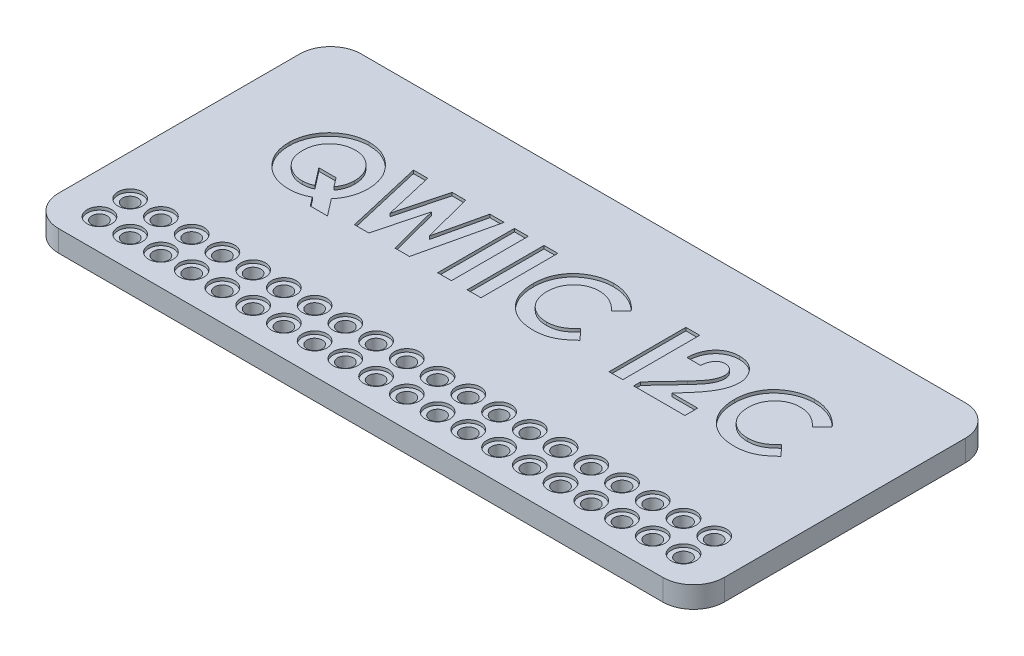
from build123d import *

# Parameters (mm, degrees)
SKETCH1_W           = 55
SKETCH1_H           = 25
BOSS_EXTRUDE1_DEPTH = 1.764763264
SKETCH2_W           = 1.13974359
SKETCH2_H           = 6.35
CUT_EXTRUDE1_DEPTH  = 0.254
SKETCH3_R           = 0.635
CUT_EXTRUDE2_DEPTH  = 31.259120896
SKETCH4_R           = 1.016
CUT_EXTRUDE3_DEPTH  = 0.254
SKETCH5_W           = 6.096
SKETCH5_H           = 4.318
BOSS_EXTRUDE2_DEPTH = 4.318
FILLET1_R           = 2.54


with BuildPart() as part:
    # Sketch1 → Boss-Extrude1 (new body)
    with BuildSketch(Plane(origin=(0, 0, 0), x_dir=(1, 0, 0), z_dir=(0, 1, 0))):
        Rectangle(SKETCH1_W, SKETCH1_H)
    extrude(amount=BOSS_EXTRUDE1_DEPTH)

    # Sketch2 → Cut-Extrude1 (cut)
    # profile 1 of 8: a face of its own
    with BuildSketch(Plane(origin=(0, 1.764763264, 0), x_dir=(1, 0, 0), z_dir=(0, 1, 0))):
        with BuildLine():
            Line((-15.834294872, 0.904417067), (-14.75688101, -0.488461538))
            Line((-14.75688101, -0.488461538), (-16.175200321, -0.488461538))
            Line((-16.175200321, -0.488461538), (-16.733623798, 0.232782452))
            add(Edge.make_bspline(
                [(-16.733623798, 0.232782452), (-16.792116964, 0.200932374), (-16.908827383, 0.137382456), (-17.091844715, 0.058136216), (-17.278250026, -0.011384371), (-17.470744385, -0.065860672), (-17.667479678, -0.108740135), (-17.869475274, -0.141479308), (-18.076586637, -0.158741946), (-18.216364964, -0.161454203), (-18.286778846, -0.162820513)],
                knots=[0, 0, 0, 0, 0.985706899, 1.966764212, 2.949968678, 3.929638882, 4.925906056, 5.930211904, 6.957336097, 8, 8, 8, 8], degree=3))
            add(Edge.make_bspline(
                [(-18.286778846, -0.162820513), (-18.40398866, -0.160189738), (-18.633880946, -0.155029804), (-18.970564269, -0.105484327), (-19.292870578, -0.03068412), (-19.599603494, 0.078602809), (-19.891796355, 0.21748214), (-20.167113329, 0.389589865), (-20.428756821, 0.590154232), (-20.67032541, 0.821143618), (-20.891356901, 1.071463593), (-21.084485579, 1.33740966), (-21.248657638, 1.614832494), (-21.382544595, 1.904167279), (-21.486655312, 2.205912823), (-21.559563224, 2.519244963), (-21.605785673, 2.844596723), (-21.611515066, 3.065448537), (-21.614423077, 3.177544071)],
                knots=[0, 0, 0, 0, 1.070144486, 2.098953612, 3.10240755, 4.088674545, 5.067611437, 6.052256776, 7.0494179, 8.074208254, 9.100739571, 10.09639475, 11.072322686, 12.041159829, 13.004031207, 13.983083054, 14.976293755, 16, 16, 16, 16], degree=3))
            add(Edge.make_bspline(
                [(-21.614423077, 3.177544071), (-21.613453659, 3.252654762), (-21.611527097, 3.401925072), (-21.588356007, 3.623141223), (-21.554924945, 3.84001928), (-21.505839646, 4.05139349), (-21.445314105, 4.258814579), (-21.368303654, 4.460633347), (-21.279055747, 4.65876622), (-21.176668642, 4.851567196), (-21.060370692, 5.03618561), (-20.936786419, 5.214088417), (-20.79931849, 5.379563519), (-20.652832499, 5.53633747), (-20.496847292, 5.684307583), (-20.328906335, 5.820423875), (-20.152200973, 5.948064266), (-19.965458009, 6.064552806), (-19.771919359, 6.169847138), (-19.573366317, 6.261355055), (-19.371310124, 6.339639166), (-19.165675395, 6.403410708), (-18.95583663, 6.451201049), (-18.743640244, 6.487588199), (-18.527162103, 6.507828957), (-18.381796204, 6.511145864), (-18.308403446, 6.512820513)],
                knots=[0, 0, 0, 0, 1.035855852, 2.058595393, 3.065553363, 4.06176554, 5.050183643, 6.044349766, 7.039272903, 8.046842428, 9.053256483, 10.04817962, 11.033146707, 12.018200652, 13.007259073, 13.996749908, 14.99846043, 16.012935138, 17.03119782, 18.036301871, 19.027088812, 20.018894167, 21.003704893, 21.994284571, 22.987348552, 24, 24, 24, 24], degree=3))
            add(Edge.make_bspline(
                [(-18.308403446, 6.512820513), (-18.197568588, 6.510002186), (-17.97916831, 6.504448668), (-17.65790292, 6.456961095), (-17.348093046, 6.381314534), (-17.051016184, 6.272020074), (-16.764856598, 6.134214357), (-16.492466249, 5.963701782), (-16.230962742, 5.763998575), (-15.985995465, 5.535008837), (-15.759609641, 5.286499829), (-15.562254621, 5.019877359), (-15.395181722, 4.740232121), (-15.25585029, 4.447452627), (-15.150879438, 4.139827796), (-15.075942845, 3.819400064), (-15.028510164, 3.485943998), (-15.022995101, 3.258690783), (-15.020192308, 3.143199119)],
                knots=[0, 0, 0, 0, 1.015551519, 2.00114601, 2.970254478, 3.93428303, 4.897362978, 5.876714212, 6.874912676, 7.909046156, 8.946527051, 9.952474942, 10.9443724, 11.928494229, 12.919233427, 13.917651329, 14.941735923, 16, 16, 16, 16], degree=3))
            add(Edge.make_bspline(
                [(-15.020192308, 3.143199119), (-15.022522433, 3.036649152), (-15.027105331, 2.82708637), (-15.066808256, 2.518147352), (-15.129476341, 2.22037152), (-15.219482998, 1.933547254), (-15.333546142, 1.657987186), (-15.475669162, 1.394511671), (-15.639554937, 1.139992719), (-15.769057941, 0.983333765), (-15.834294872, 0.904417067)],
                knots=[0, 0, 0, 0, 1.049646143, 2.064447078, 3.064298101, 4.044929938, 5.022708814, 5.998521441, 6.991758374, 8, 8, 8, 8], degree=3))
        make_face()
        with BuildLine():
            add(Edge.make_bspline(
                [(-16.582251603, 1.873707933), (-16.548325017, 1.922348156), (-16.481253486, 2.018507971), (-16.396386347, 2.171030514), (-16.323484515, 2.326524897), (-16.263197554, 2.485807056), (-16.217337332, 2.649789814), (-16.184740921, 2.817402638), (-16.163154991, 2.988722288), (-16.16101454, 3.104124683), (-16.159935897, 3.162279647)],
                knots=[0, 0, 0, 0, 1.031533623, 2.039301536, 3.033003023, 4.018477747, 4.999688364, 5.992485227, 6.988348989, 8, 8, 8, 8], degree=3))
            add(Edge.make_bspline(
                [(-16.159935897, 3.162279647), (-16.161943424, 3.237845659), (-16.165894935, 3.386585829), (-16.195573941, 3.605236068), (-16.24529398, 3.814781972), (-16.314621115, 4.015736428), (-16.401927664, 4.208615283), (-16.511603135, 4.391812485), (-16.640457409, 4.566279532), (-16.787246621, 4.730336235), (-16.947061538, 4.880484434), (-17.117028584, 5.012720876), (-17.295981844, 5.124280889), (-17.484026003, 5.214358315), (-17.679121234, 5.286909289), (-17.883361204, 5.335605876), (-18.094965737, 5.367534661), (-18.239170909, 5.371213413), (-18.312219551, 5.373076923)],
                knots=[0, 0, 0, 0, 1.056263418, 2.079093448, 3.078410197, 4.062632158, 5.04680056, 6.032966551, 7.041959893, 8.074807684, 9.106532056, 10.103754224, 11.080880922, 12.048629763, 13.014470275, 13.984975, 14.979267944, 16, 16, 16, 16], degree=3))
            add(Edge.make_bspline(
                [(-18.312219551, 5.373076923), (-18.387371614, 5.371110704), (-18.535286953, 5.367240764), (-18.75243943, 5.336989388), (-18.96073452, 5.289538978), (-19.159077336, 5.219869765), (-19.348068424, 5.132085037), (-19.527699114, 5.024371468), (-19.697069167, 4.896125921), (-19.856581268, 4.751104817), (-20.00070603, 4.590183753), (-20.127976716, 4.417622418), (-20.234498979, 4.233836915), (-20.323707473, 4.040500879), (-20.390862832, 3.835449288), (-20.438695281, 3.620285919), (-20.46892368, 3.394640698), (-20.472734001, 3.240818619), (-20.474679487, 3.162279647)],
                knots=[0, 0, 0, 0, 1.042613217, 2.052085894, 3.036973397, 4.002832266, 4.963730975, 5.924467509, 6.903642813, 7.907474205, 8.911719447, 9.896835452, 10.877830278, 11.85475743, 12.846581833, 13.865885605, 14.910357018, 16, 16, 16, 16], degree=3))
            add(Edge.make_bspline(
                [(-20.474679487, 3.162279647), (-20.472100636, 3.075240402), (-20.467046516, 2.904657902), (-20.431469273, 2.65582353), (-20.370642583, 2.420798568), (-20.282664541, 2.200851867), (-20.173947341, 1.992886648), (-20.036982251, 1.801332194), (-19.877717026, 1.622401032), (-19.754775809, 1.518247205), (-19.692377804, 1.465384615)],
                knots=[0, 0, 0, 0, 1.078047314, 2.112794111, 3.106520711, 4.077995885, 5.041371964, 6.006121678, 6.988020189, 8, 8, 8, 8], degree=3))
            add(Edge.make_bspline(
                [(-19.692377804, 1.465384615), (-19.641324362, 1.426252868), (-19.540081078, 1.34865131), (-19.37789824, 1.250423386), (-19.211670368, 1.165092352), (-19.039825689, 1.096871117), (-18.862957847, 1.042615035), (-18.681104452, 1.005031636), (-18.493910282, 0.981108193), (-18.367414459, 0.978330577), (-18.303315304, 0.976923077)],
                knots=[0, 0, 0, 0, 1.027457745, 2.037535419, 3.025615023, 4.011018129, 4.9886297, 5.978868484, 6.975833209, 8, 8, 8, 8], degree=3))
            add(Edge.make_bspline(
                [(-18.303315304, 0.976923077), (-18.229771649, 0.979264788), (-18.083801028, 0.983912654), (-17.86894524, 1.024399703), (-17.659605991, 1.084949011), (-17.528366854, 1.146841689), (-17.4625, 1.177904647)],
                knots=[0, 0, 0, 0, 1.010952568, 2.006554787, 2.999521277, 4, 4, 4, 4], degree=3))
            Line((-17.4625, 1.177904647), (-18.565354567, 2.605128205))
            Line((-18.565354567, 2.605128205), (-17.147035256, 2.605128205))
            Line((-17.147035256, 2.605128205), (-16.582251603, 1.873707933))
        make_face(mode=Mode.SUBTRACT)
    # profile 2 of 8: a face of its own
    with BuildSketch(Plane(origin=(0, 1.764763264, 0), x_dir=(1, 0, 0), z_dir=(0, 1, 0))):
        Polygon((-14.491025641, 6.35), (-13.314393029, 6.35), (-12.374358974, 2.296023638), (-11.296945112, 6.35), (-10.189002404, 6.35), (-9.117948718, 2.296023638), (-8.180458734, 6.35), (-7.001282051, 6.35), (-8.470482772, 0), (-9.661107772, 0), (-10.746153846, 4.104857772), (-11.837560096, 0), (-13.019280849, 0), align=None)
    # profile 3 of 8: a face of its own
    with BuildSketch(Plane(origin=(0, 1.764763264, 0), x_dir=(1, 0, 0), z_dir=(0, 1, 0))):
        with Locations((-5.576602564, 3.175)):
            Rectangle(SKETCH2_W, SKETCH2_H)
    # profile 4 of 8: a face of its own
    with BuildSketch(Plane(origin=(0, 1.764763264, 0), x_dir=(1, 0, 0), z_dir=(0, 1, 0))):
        with Locations((-3.134294872, 3.175)):
            Rectangle(SKETCH2_W, SKETCH2_H)
    # profile 5 of 8: a face of its own
    with BuildSketch(Plane(origin=(0, 1.764763264, 0), x_dir=(1, 0, 0), z_dir=(0, 1, 0))):
        with BuildLine():
            Line((4.599679487, 5.248417468), (3.763952324, 4.449579327))
            add(Edge.make_bspline(
                [(3.763952324, 4.449579327), (3.693059137, 4.522883001), (3.554582534, 4.666068041), (3.331444613, 4.855632415), (3.099389301, 5.013608672), (2.862930769, 5.14665527), (2.617815814, 5.247314504), (2.366878632, 5.320666583), (2.108516916, 5.365386573), (1.933667645, 5.370503331), (1.845723157, 5.373076923)],
                knots=[0, 0, 0, 0, 1.115251505, 2.178435587, 3.19620269, 4.182487026, 5.141301733, 6.088180966, 7.038406374, 8, 8, 8, 8], degree=3))
            add(Edge.make_bspline(
                [(1.845723157, 5.373076923), (1.772278823, 5.371043695), (1.62734452, 5.367031345), (1.414542985, 5.337616856), (1.210987318, 5.287596239), (1.015980717, 5.218658562), (0.830096998, 5.129456867), (0.65294643, 5.020060193), (0.484965773, 4.891456549), (0.328373953, 4.744311336), (0.18512926, 4.583544132), (0.058563452, 4.41200591), (-0.047455715, 4.230089652), (-0.13446392, 4.039637675), (-0.202239948, 3.83976847), (-0.250640548, 3.630616599), (-0.278634161, 3.411932978), (-0.282812396, 3.263273482), (-0.284935897, 3.187720353)],
                knots=[0, 0, 0, 0, 1.035432265, 2.043311493, 3.022114605, 3.98653278, 4.95457646, 5.923598177, 6.917315552, 7.932509744, 8.948865224, 9.949768934, 10.933144597, 11.912367597, 12.897413939, 13.903909035, 14.934704909, 16, 16, 16, 16], degree=3))
            add(Edge.make_bspline(
                [(-0.284935897, 3.187720353), (-0.284323928, 3.13469188), (-0.283117725, 3.030171672), (-0.269913696, 2.875557275), (-0.248652096, 2.725544757), (-0.217881292, 2.580361347), (-0.1794021, 2.439881229), (-0.134257246, 2.302892487), (-0.077623691, 2.171287997), (-0.01475959, 2.043539259), (0.058350635, 1.923132056), (0.137176945, 1.808313796), (0.222651208, 1.699647305), (0.315327046, 1.597576816), (0.416508757, 1.503697461), (0.523581167, 1.415186177), (0.63835044, 1.334258702), (0.758432527, 1.25888407), (0.884864786, 1.193405487), (1.014216817, 1.13409454), (1.148449857, 1.085925233), (1.285929537, 1.047096377), (1.426164555, 1.014078234), (1.570526538, 0.993747949), (1.71776405, 0.978352061), (1.817271894, 0.977401455), (1.867347756, 0.976923077)],
                knots=[0, 0, 0, 0, 1.103660481, 2.175337485, 3.227646561, 4.255952547, 5.262355991, 6.258840057, 7.255597736, 8.242457506, 9.22035537, 10.185017736, 11.140346927, 12.096287581, 13.051739095, 14.01125915, 14.986044842, 15.97314143, 16.960198552, 17.947847494, 18.933482797, 19.925264591, 20.920966487, 21.929612487, 22.958107872, 24, 24, 24, 24], degree=3))
            add(Edge.make_bspline(
                [(1.867347756, 0.976923077), (1.952285024, 0.979379913), (2.119164669, 0.984206958), (2.364084542, 1.021953766), (2.597468781, 1.084045128), (2.783941671, 1.157371419), (2.930038255, 1.229782084), (3.041259425, 1.296758383), (3.156270783, 1.371678726), (3.273162089, 1.45737069), (3.393248139, 1.552805936), (3.514409136, 1.660074673), (3.639746823, 1.775644697), (3.7218543, 1.858129293), (3.763952324, 1.900420673)],
                knots=[0, 0, 0, 0, 1.404581149, 2.759636711, 4.088442092, 5.392261763, 6.066678138, 6.783632037, 7.538459478, 8.336747902, 9.180226004, 10.074962426, 11.012997595, 12, 12, 12, 12], degree=3))
            Line((3.763952324, 1.900420673), (4.574238782, 1.049429087))
            add(Edge.make_bspline(
                [(4.574238782, 1.049429087), (4.517280005, 0.994437176), (4.406108655, 0.887104727), (4.238409758, 0.734702665), (4.070921917, 0.59775247), (3.907691289, 0.471283451), (3.746043986, 0.358979957), (3.585997151, 0.26072983), (3.429362584, 0.174048181), (3.272887717, 0.100396854), (3.115598883, 0.037859228), (2.953767157, -0.015981563), (2.786897804, -0.061528935), (2.613971662, -0.098279682), (2.436601681, -0.127748821), (2.253127914, -0.147640319), (2.064713674, -0.161012711), (1.936909376, -0.162214331), (1.872435897, -0.162820513)],
                knots=[0, 0, 0, 0, 1.244526981, 2.429050516, 3.560637417, 4.644440555, 5.67424972, 6.652764056, 7.595344123, 8.486817594, 9.369275933, 10.254498637, 11.166417451, 12.086725134, 13.032340136, 13.991389299, 14.986715468, 16, 16, 16, 16], degree=3))
            add(Edge.make_bspline(
                [(1.872435897, -0.162820513), (1.754006104, -0.159801501), (1.522271919, -0.153894135), (1.182671512, -0.110124548), (0.860060241, -0.036745608), (0.553653254, 0.067032454), (0.263547981, 0.199604063), (-0.010181361, 0.362130632), (-0.26709358, 0.554180352), (-0.505113331, 0.773502214), (-0.720413525, 1.015724798), (-0.910713962, 1.275805403), (-1.068130492, 1.555022228), (-1.198836828, 1.84925035), (-1.301047464, 2.159832444), (-1.372986424, 2.487104468), (-1.417350656, 2.830750419), (-1.422204166, 3.065468525), (-1.424679487, 3.185176282)],
                knots=[0, 0, 0, 0, 1.078019885, 2.10938526, 3.111377082, 4.085535484, 5.04941344, 6.010039228, 6.978205633, 7.964457913, 8.951525778, 9.924444315, 10.892603023, 11.863865945, 12.85144698, 13.863884204, 14.910567087, 16, 16, 16, 16], degree=3))
            add(Edge.make_bspline(
                [(-1.424679487, 3.185176282), (-1.423633536, 3.26324866), (-1.421560717, 3.417969031), (-1.399775196, 3.645884672), (-1.369404914, 3.868061655), (-1.321225222, 4.082193045), (-1.263149355, 4.291163588), (-1.190924384, 4.492702018), (-1.104665663, 4.687387576), (-1.007153513, 4.875546178), (-0.896838993, 5.055945184), (-0.773605564, 5.227034681), (-0.640625734, 5.390135449), (-0.494704216, 5.543083654), (-0.337961441, 5.68722221), (-0.169689731, 5.821770003), (0.009098841, 5.948656601), (0.198888192, 6.064609906), (0.395991218, 6.169495833), (0.597921932, 6.2620097), (0.804184215, 6.339329989), (1.01390597, 6.403464316), (1.227973268, 6.451336056), (1.444858153, 6.48757342), (1.666406054, 6.507830337), (1.815156277, 6.511146524), (1.890244391, 6.512820513)],
                knots=[0, 0, 0, 0, 1.071919942, 2.124283339, 3.142214191, 4.149696895, 5.136002878, 6.119640489, 7.086990633, 8.058538607, 9.028339693, 9.988281803, 10.952401235, 11.916291999, 12.888973767, 13.874849856, 14.873389453, 15.898127285, 16.927174885, 17.938320013, 18.946391617, 19.950418109, 20.947802303, 21.956882652, 22.968648068, 24, 24, 24, 24], degree=3))
            add(Edge.make_bspline(
                [(1.890244391, 6.512820513), (1.954302252, 6.511860941), (2.081751949, 6.509951773), (2.271545936, 6.494036786), (2.45982204, 6.469042458), (2.645906174, 6.431331341), (2.831129402, 6.38656348), (3.013057684, 6.32794614), (3.194561036, 6.262606069), (3.372792848, 6.184505355), (3.548001906, 6.099251372), (3.716083661, 6.002527631), (3.87986019, 5.900286405), (4.035702304, 5.786476609), (4.186529262, 5.665226336), (4.331552376, 5.535969886), (4.469498982, 5.396552174), (4.556066613, 5.298045331), (4.599679487, 5.248417468)],
                knots=[0, 0, 0, 0, 0.996412454, 1.982464992, 2.961075852, 3.949442424, 4.934965278, 5.923860011, 6.921385422, 7.934793307, 8.949617135, 9.951082467, 10.950285876, 11.951772932, 12.951063433, 13.960125323, 14.972308753, 16, 16, 16, 16], degree=3))
        make_face()
    # profile 6 of 8: a face of its own
    with BuildSketch(Plane(origin=(0, 1.764763264, 0), x_dir=(1, 0, 0), z_dir=(0, 1, 0))):
        with Locations((8.588782051, 3.175)):
            Rectangle(SKETCH2_W, SKETCH2_H)
    # profile 7 of 8: a face of its own
    with BuildSketch(Plane(origin=(0, 1.764763264, 0), x_dir=(1, 0, 0), z_dir=(0, 1, 0))):
        with BuildLine():
            Line((11.356730769, 4.233333333), (10.216987179, 4.233333333))
            add(Edge.make_bspline(
                [(10.216987179, 4.233333333), (10.221909557, 4.319548906), (10.231527588, 4.488008959), (10.269785683, 4.73270258), (10.321050217, 4.963911144), (10.389469543, 5.180825859), (10.475442903, 5.383367905), (10.576757981, 5.572227758), (10.696003147, 5.746411067), (10.830640472, 5.905077822), (10.978384184, 6.047419232), (11.136166979, 6.173628069), (11.306402357, 6.277772425), (11.485979978, 6.363473588), (11.674869265, 6.431944834), (11.874857406, 6.477723404), (12.084212796, 6.508725099), (12.227533514, 6.511437872), (12.300580929, 6.512820513)],
                knots=[0, 0, 0, 0, 1.199038563, 2.342849363, 3.436047546, 4.486744587, 5.497670872, 6.488682221, 7.459191391, 8.424610317, 9.374430501, 10.305433194, 11.225809216, 12.140057399, 13.06607119, 14.010487599, 14.985989317, 16, 16, 16, 16], degree=3))
            add(Edge.make_bspline(
                [(12.300580929, 6.512820513), (12.390245596, 6.510022739), (12.565292037, 6.504560828), (12.8196484, 6.45796892), (13.057189433, 6.380036753), (13.277742465, 6.271144963), (13.479429891, 6.132809358), (13.662218263, 5.96786679), (13.820579772, 5.772856677), (13.955518474, 5.555893071), (14.067636409, 5.326159147), (14.146203987, 5.088604743), (14.197845611, 4.84953359), (14.20335351, 4.688555176), (14.206089744, 4.608583734)],
                knots=[0, 0, 0, 0, 1.075374347, 2.099382735, 3.09057751, 4.06680945, 5.040638231, 6.016817125, 7.011024321, 8.044445721, 9.0776792, 10.070479129, 11.0414456, 12, 12, 12, 12], degree=3))
            add(Edge.make_bspline(
                [(14.206089744, 4.608583734), (14.205024399, 4.560211354), (14.202880122, 4.4628497), (14.187970684, 4.315517623), (14.16560358, 4.165442677), (14.131879438, 4.012753538), (14.089822668, 3.857407404), (14.038801728, 3.698939378), (13.977633136, 3.538247915), (13.907337672, 3.373524461), (13.823475005, 3.204234223), (13.725828587, 3.027839474), (13.611806659, 2.84449669), (13.482786464, 2.653170659), (13.33814138, 2.454163131), (13.177165299, 2.248073579), (13.001712287, 2.034175809), (12.877188348, 1.891197153), (12.813211138, 1.817738381)],
                knots=[0, 0, 0, 0, 0.728284026, 1.46585585, 2.227944881, 3.01186502, 3.81876927, 4.650621989, 5.517437689, 6.406905708, 7.346299482, 8.360816762, 9.441613733, 10.596154504, 11.834900912, 13.145207542, 14.533280747, 16, 16, 16, 16], degree=3))
            Line((12.813211138, 1.817738381), (12.150480769, 1.058333333))
            Line((12.150480769, 1.058333333), (14.2875, 1.058333333))
            Line((14.2875, 1.058333333), (14.2875, 0))
            Line((14.2875, 0), (10.054166667, 0))
            Line((10.054166667, 0), (10.054166667, 0.577504006))
            Line((10.054166667, 0.577504006), (11.934234776, 2.578415465))
            add(Edge.make_bspline(
                [(11.934234776, 2.578415465), (11.988667579, 2.636782673), (12.094087776, 2.749822647), (12.244089853, 2.915833875), (12.379828482, 3.073374567), (12.498489012, 3.224122215), (12.606298596, 3.363187178), (12.698450012, 3.494761048), (12.775786374, 3.617654349), (12.859745963, 3.765842206), (12.939479974, 3.942582597), (13.012640754, 4.146194773), (13.057237313, 4.340801121), (13.063393048, 4.4676108), (13.066346154, 4.528445513)],
                knots=[0, 0, 0, 0, 1.246127091, 2.413378631, 3.493388633, 4.492180848, 5.408488754, 6.240484944, 6.999099869, 7.674939598, 8.898438119, 10.020720584, 11.050475521, 12, 12, 12, 12], degree=3))
            add(Edge.make_bspline(
                [(13.066346154, 4.528445513), (13.064138188, 4.587298404), (13.0598599, 4.701335317), (13.012844984, 4.863552217), (12.940007845, 5.010423062), (12.83737003, 5.137559183), (12.71304349, 5.242035364), (12.569372495, 5.319741812), (12.407528385, 5.364578077), (12.294072581, 5.370189975), (12.235707131, 5.373076923)],
                knots=[0, 0, 0, 0, 1.062038974, 2.057870785, 3.028805853, 4.01125022, 4.991535629, 5.949134679, 6.94496649, 8, 8, 8, 8], degree=3))
            add(Edge.make_bspline(
                [(12.235707131, 5.373076923), (12.205554797, 5.37201045), (12.146195084, 5.369910926), (12.058940946, 5.355934967), (11.975912365, 5.331303796), (11.896185187, 5.298301494), (11.820610281, 5.254556706), (11.74937827, 5.200634286), (11.681738637, 5.137904524), (11.618001602, 5.066563568), (11.55999258, 4.98694704), (11.508469179, 4.899782075), (11.465867904, 4.805122778), (11.428360192, 4.704218797), (11.399432451, 4.59598634), (11.378369466, 4.481073167), (11.362356686, 4.359666226), (11.35864019, 4.27621037), (11.356730769, 4.233333333)],
                knots=[0, 0, 0, 0, 0.903469896, 1.778625579, 2.63899355, 3.493148037, 4.358286772, 5.247621495, 6.164656832, 7.118446693, 8.109501108, 9.111810964, 10.146451449, 11.215617525, 12.33435995, 13.498009769, 14.714554818, 16, 16, 16, 16], degree=3))
        make_face()
    # profile 8 of 8: a face of its own
    with BuildSketch(Plane(origin=(0, 1.764763264, 0), x_dir=(1, 0, 0), z_dir=(0, 1, 0))):
        with BuildLine():
            Line((21.207371795, 5.248417468), (20.371644631, 4.449579327))
            add(Edge.make_bspline(
                [(20.371644631, 4.449579327), (20.300751445, 4.522883001), (20.162274842, 4.666068041), (19.939136921, 4.855632415), (19.707081608, 5.013608672), (19.470623076, 5.14665527), (19.225508121, 5.247314504), (18.97457094, 5.320666583), (18.716209224, 5.365386573), (18.541359952, 5.370503331), (18.453415465, 5.373076923)],
                knots=[0, 0, 0, 0, 1.115251505, 2.178435587, 3.19620269, 4.182487026, 5.141301733, 6.088180966, 7.038406374, 8, 8, 8, 8], degree=3))
            add(Edge.make_bspline(
                [(18.453415465, 5.373076923), (18.37997113, 5.371043695), (18.235036828, 5.367031345), (18.022235293, 5.337616856), (17.818679626, 5.287596239), (17.623673025, 5.218658562), (17.437789305, 5.129456867), (17.260638738, 5.020060193), (17.092658081, 4.891456549), (16.936066261, 4.744311336), (16.792821567, 4.583544132), (16.666255759, 4.41200591), (16.560236593, 4.230089652), (16.473228388, 4.039637675), (16.405452359, 3.83976847), (16.35705176, 3.630616599), (16.329058146, 3.411932978), (16.324879912, 3.263273482), (16.32275641, 3.187720353)],
                knots=[0, 0, 0, 0, 1.035432265, 2.043311493, 3.022114605, 3.98653278, 4.95457646, 5.923598177, 6.917315552, 7.932509744, 8.948865224, 9.949768934, 10.933144597, 11.912367597, 12.897413939, 13.903909035, 14.934704909, 16, 16, 16, 16], degree=3))
            add(Edge.make_bspline(
                [(16.32275641, 3.187720353), (16.323368379, 3.13469188), (16.324574583, 3.030171672), (16.337778612, 2.875557275), (16.359040212, 2.725544757), (16.389811015, 2.580361347), (16.428290208, 2.439881229), (16.473435062, 2.302892487), (16.530068617, 2.171287997), (16.592932718, 2.043539259), (16.666042943, 1.923132056), (16.744869252, 1.808313796), (16.830343515, 1.699647305), (16.923019354, 1.597576816), (17.024201064, 1.503697461), (17.131273475, 1.415186177), (17.246042748, 1.334258702), (17.366124835, 1.25888407), (17.492557094, 1.193405487), (17.621909125, 1.13409454), (17.756142164, 1.085925233), (17.893621845, 1.047096377), (18.033856863, 1.014078234), (18.178218846, 0.993747949), (18.325456358, 0.978352061), (18.424964202, 0.977401455), (18.475040064, 0.976923077)],
                knots=[0, 0, 0, 0, 1.103660481, 2.175337485, 3.227646561, 4.255952547, 5.262355991, 6.258840057, 7.255597736, 8.242457506, 9.22035537, 10.185017736, 11.140346927, 12.096287581, 13.051739095, 14.01125915, 14.986044842, 15.97314143, 16.960198552, 17.947847494, 18.933482797, 19.925264591, 20.920966487, 21.929612487, 22.958107872, 24, 24, 24, 24], degree=3))
            add(Edge.make_bspline(
                [(18.475040064, 0.976923077), (18.559977332, 0.979379913), (18.726856976, 0.984206958), (18.97177685, 1.021953766), (19.205161089, 1.084045128), (19.391633979, 1.157371419), (19.537730563, 1.229782084), (19.648951733, 1.296758383), (19.763963091, 1.371678726), (19.880854397, 1.45737069), (20.000940446, 1.552805936), (20.122101443, 1.660074673), (20.247439131, 1.775644697), (20.329546608, 1.858129293), (20.371644631, 1.900420673)],
                knots=[0, 0, 0, 0, 1.404581149, 2.759636711, 4.088442092, 5.392261763, 6.066678138, 6.783632037, 7.538459478, 8.336747902, 9.180226004, 10.074962426, 11.012997595, 12, 12, 12, 12], degree=3))
            Line((20.371644631, 1.900420673), (21.18193109, 1.049429087))
            add(Edge.make_bspline(
                [(21.18193109, 1.049429087), (21.124972313, 0.994437176), (21.013800962, 0.887104727), (20.846102066, 0.734702665), (20.678614225, 0.59775247), (20.515383597, 0.471283451), (20.353736294, 0.358979957), (20.193689459, 0.26072983), (20.037054891, 0.174048181), (19.880580024, 0.100396854), (19.723291191, 0.037859228), (19.561459465, -0.015981563), (19.394590112, -0.061528935), (19.22166397, -0.098279682), (19.044293989, -0.127748821), (18.860820221, -0.147640319), (18.672405981, -0.161012711), (18.544601683, -0.162214331), (18.480128205, -0.162820513)],
                knots=[0, 0, 0, 0, 1.244526981, 2.429050516, 3.560637417, 4.644440555, 5.67424972, 6.652764056, 7.595344123, 8.486817594, 9.369275933, 10.254498637, 11.166417451, 12.086725134, 13.032340136, 13.991389299, 14.986715468, 16, 16, 16, 16], degree=3))
            add(Edge.make_bspline(
                [(18.480128205, -0.162820513), (18.361698412, -0.159801501), (18.129964226, -0.153894135), (17.790363819, -0.110124548), (17.467752549, -0.036745608), (17.161345562, 0.067032454), (16.871240289, 0.199604063), (16.597510947, 0.362130632), (16.340598728, 0.554180352), (16.102578976, 0.773502214), (15.887278783, 1.015724798), (15.696978345, 1.275805403), (15.539561816, 1.555022228), (15.40885548, 1.84925035), (15.306644844, 2.159832444), (15.234705884, 2.487104468), (15.190341652, 2.830750419), (15.185488142, 3.065468525), (15.183012821, 3.185176282)],
                knots=[0, 0, 0, 0, 1.078019885, 2.10938526, 3.111377082, 4.085535484, 5.04941344, 6.010039228, 6.978205633, 7.964457913, 8.951525778, 9.924444315, 10.892603023, 11.863865945, 12.85144698, 13.863884204, 14.910567087, 16, 16, 16, 16], degree=3))
            add(Edge.make_bspline(
                [(15.183012821, 3.185176282), (15.184058771, 3.26324866), (15.186131591, 3.417969031), (15.207917111, 3.645884672), (15.238287394, 3.868061655), (15.286467086, 4.082193045), (15.344542953, 4.291163588), (15.416767924, 4.492702018), (15.503026645, 4.687387576), (15.600538795, 4.875546178), (15.710853315, 5.055945184), (15.834086744, 5.227034681), (15.967066573, 5.390135449), (16.112988091, 5.543083654), (16.269730867, 5.68722221), (16.438002576, 5.821770003), (16.616791149, 5.948656601), (16.806580499, 6.064609906), (17.003683526, 6.169495833), (17.20561424, 6.2620097), (17.411876523, 6.339329989), (17.621598277, 6.403464316), (17.835665576, 6.451336056), (18.052550461, 6.48757342), (18.274098362, 6.507830337), (18.422848584, 6.511146524), (18.497936699, 6.512820513)],
                knots=[0, 0, 0, 0, 1.071919942, 2.124283339, 3.142214191, 4.149696895, 5.136002878, 6.119640489, 7.086990633, 8.058538607, 9.028339693, 9.988281803, 10.952401235, 11.916291999, 12.888973767, 13.874849856, 14.873389453, 15.898127285, 16.927174885, 17.938320013, 18.946391617, 19.950418109, 20.947802303, 21.956882652, 22.968648068, 24, 24, 24, 24], degree=3))
            add(Edge.make_bspline(
                [(18.497936699, 6.512820513), (18.561994559, 6.511860941), (18.689444257, 6.509951773), (18.879238244, 6.494036786), (19.067514348, 6.469042458), (19.253598482, 6.431331341), (19.43882171, 6.38656348), (19.620749991, 6.32794614), (19.802253344, 6.262606069), (19.980485156, 6.184505355), (20.155694213, 6.099251372), (20.323775968, 6.002527631), (20.487552498, 5.900286405), (20.643394612, 5.786476609), (20.79422157, 5.665226336), (20.939244683, 5.535969886), (21.07719129, 5.396552174), (21.163758921, 5.298045331), (21.207371795, 5.248417468)],
                knots=[0, 0, 0, 0, 0.996412454, 1.982464992, 2.961075852, 3.949442424, 4.934965278, 5.923860011, 6.921385422, 7.934793307, 8.949617135, 9.951082467, 10.950285876, 11.951772932, 12.951063433, 13.960125323, 14.972308753, 16, 16, 16, 16], degree=3))
        make_face()
    extrude(amount=-CUT_EXTRUDE1_DEPTH, mode=Mode.SUBTRACT)

    # Sketch3 → Cut-Extrude2 (cut, through all)
    with BuildSketch(Plane(origin=(0, 1.764763264, 0), x_dir=(1, 0, 0), z_dir=(0, 1, 0))):
        with Locations(Location((-24.13, -9.96, 0), (0, 0, 270))):
            Circle(SKETCH3_R)
        with Locations(Location((-21.59, -9.96, 0), (0, 0, 270))):
            Circle(SKETCH3_R)
        with Locations(Location((-19.05, -9.96, 0), (0, 0, 270))):
            Circle(SKETCH3_R)
        with Locations(Location((-16.51, -9.96, 0), (0, 0, 270))):
            Circle(SKETCH3_R)
        with Locations(Location((-13.97, -9.96, 0), (0, 0, 270))):
            Circle(SKETCH3_R)
        with Locations(Location((-11.43, -9.96, 0), (0, 0, 270))):
            Circle(SKETCH3_R)
        with Locations(Location((-8.89, -9.96, 0), (0, 0, 270))):
            Circle(SKETCH3_R)
        with Locations(Location((-6.35, -9.96, 0), (0, 0, 270))):
            Circle(SKETCH3_R)
        with Locations(Location((-3.81, -9.96, 0), (0, 0, 270))):
            Circle(SKETCH3_R)
        with Locations(Location((-1.27, -9.96, 0), (0, 0, 270))):
            Circle(SKETCH3_R)
        with Locations(Location((1.27, -9.96, 0), (0, 0, 270))):
            Circle(SKETCH3_R)
        with Locations(Location((3.81, -9.96, 0), (0, 0, 270))):
            Circle(SKETCH3_R)
        with Locations(Location((6.35, -9.96, 0), (0, 0, 270))):
            Circle(SKETCH3_R)
        with Locations(Location((8.89, -9.96, 0), (0, 0, 270))):
            Circle(SKETCH3_R)
        with Locations(Location((11.43, -9.96, 0), (0, 0, 270))):
            Circle(SKETCH3_R)
        with Locations(Location((13.97, -9.96, 0), (0, 0, 270))):
            Circle(SKETCH3_R)
        with Locations(Location((16.51, -9.96, 0), (0, 0, 270))):
            Circle(SKETCH3_R)
        with Locations(Location((19.05, -9.96, 0), (0, 0, 270))):
            Circle(SKETCH3_R)
        with Locations(Location((21.59, -9.96, 0), (0, 0, 270))):
            Circle(SKETCH3_R)
        with Locations(Location((24.13, -9.96, 0), (0, 0, 270))):
            Circle(SKETCH3_R)
        with Locations(Location((-21.59, -7.42, 0), (0, 0, 270))):
            Circle(SKETCH3_R)
        with Locations(Location((-19.05, -7.42, 0), (0, 0, 270))):
            Circle(SKETCH3_R)
        with Locations(Location((-16.51, -7.42, 0), (0, 0, 270))):
            Circle(SKETCH3_R)
        with Locations(Location((-13.97, -7.42, 0), (0, 0, 270))):
            Circle(SKETCH3_R)
        with Locations(Location((-11.43, -7.42, 0), (0, 0, 270))):
            Circle(SKETCH3_R)
        with Locations(Location((-8.89, -7.42, 0), (0, 0, 270))):
            Circle(SKETCH3_R)
        with Locations(Location((-6.35, -7.42, 0), (0, 0, 270))):
            Circle(SKETCH3_R)
        with Locations(Location((-3.81, -7.42, 0), (0, 0, 270))):
            Circle(SKETCH3_R)
        with Locations(Location((-1.27, -7.42, 0), (0, 0, 270))):
            Circle(SKETCH3_R)
        with Locations(Location((1.27, -7.42, 0), (0, 0, 270))):
            Circle(SKETCH3_R)
        with Locations(Location((3.81, -7.42, 0), (0, 0, 270))):
            Circle(SKETCH3_R)
        with Locations(Location((6.35, -7.42, 0), (0, 0, 270))):
            Circle(SKETCH3_R)
        with Locations(Location((8.89, -7.42, 0), (0, 0, 270))):
            Circle(SKETCH3_R)
        with Locations(Location((11.43, -7.42, 0), (0, 0, 270))):
            Circle(SKETCH3_R)
        with Locations(Location((13.97, -7.42, 0), (0, 0, 270))):
            Circle(SKETCH3_R)
        with Locations(Location((16.51, -7.42, 0), (0, 0, 270))):
            Circle(SKETCH3_R)
        with Locations(Location((19.05, -7.42, 0), (0, 0, 270))):
            Circle(SKETCH3_R)
        with Locations(Location((21.59, -7.42, 0), (0, 0, 270))):
            Circle(SKETCH3_R)
        with Locations(Location((24.13, -7.42, 0), (0, 0, 270))):
            Circle(SKETCH3_R)
        with Locations(Location((-24.13, -7.42, 0), (0, 0, 270))):
            Circle(SKETCH3_R)
    extrude(amount=-CUT_EXTRUDE2_DEPTH, mode=Mode.SUBTRACT)

    # Sketch4 → Cut-Extrude3 (cut)
    with BuildSketch(Plane(origin=(0, 1.764763264, 0), x_dir=(1, 0, 0), z_dir=(0, 1, 0))):
        with Locations(Location((-24.13, -9.96, 0), (0, 0, 270))):
            Circle(SKETCH4_R)
        with Locations(Location((-21.59, -9.96, 0), (0, 0, 270))):
            Circle(SKETCH4_R)
        with Locations(Location((-19.05, -9.96, 0), (0, 0, 270))):
            Circle(SKETCH4_R)
        with Locations(Location((-16.51, -9.96, 0), (0, 0, 270))):
            Circle(SKETCH4_R)
        with Locations(Location((-13.97, -9.96, 0), (0, 0, 270))):
            Circle(SKETCH4_R)
        with Locations(Location((-11.43, -9.96, 0), (0, 0, 270))):
            Circle(SKETCH4_R)
        with Locations(Location((-8.89, -9.96, 0), (0, 0, 270))):
            Circle(SKETCH4_R)
        with Locations(Location((-6.35, -9.96, 0), (0, 0, 270))):
            Circle(SKETCH4_R)
        with Locations(Location((-3.81, -9.96, 0), (0, 0, 270))):
            Circle(SKETCH4_R)
        with Locations(Location((-1.27, -9.96, 0), (0, 0, 270))):
            Circle(SKETCH4_R)
        with Locations(Location((1.27, -9.96, 0), (0, 0, 270))):
            Circle(SKETCH4_R)
        with Locations(Location((3.81, -9.96, 0), (0, 0, 270))):
            Circle(SKETCH4_R)
        with Locations(Location((6.35, -9.96, 0), (0, 0, 270))):
            Circle(SKETCH4_R)
        with Locations(Location((8.89, -9.96, 0), (0, 0, 270))):
            Circle(SKETCH4_R)
        with Locations(Location((11.43, -9.96, 0), (0, 0, 270))):
            Circle(SKETCH4_R)
        with Locations(Location((13.97, -9.96, 0), (0, 0, 270))):
            Circle(SKETCH4_R)
        with Locations(Location((16.51, -9.96, 0), (0, 0, 270))):
            Circle(SKETCH4_R)
        with Locations(Location((19.05, -9.96, 0), (0, 0, 270))):
            Circle(SKETCH4_R)
        with Locations(Location((21.59, -9.96, 0), (0, 0, 270))):
            Circle(SKETCH4_R)
        with Locations(Location((24.13, -9.96, 0), (0, 0, 270))):
            Circle(SKETCH4_R)
        with Locations(Location((-21.59, -7.42, 0), (0, 0, 270))):
            Circle(SKETCH4_R)
        with Locations(Location((-19.05, -7.42, 0), (0, 0, 270))):
            Circle(SKETCH4_R)
        with Locations(Location((-16.51, -7.42, 0), (0, 0, 270))):
            Circle(SKETCH4_R)
        with Locations(Location((-13.97, -7.42, 0), (0, 0, 270))):
            Circle(SKETCH4_R)
        with Locations(Location((-11.43, -7.42, 0), (0, 0, 270))):
            Circle(SKETCH4_R)
        with Locations(Location((-8.89, -7.42, 0), (0, 0, 270))):
            Circle(SKETCH4_R)
        with Locations(Location((-6.35, -7.42, 0), (0, 0, 270))):
            Circle(SKETCH4_R)
        with Locations(Location((-3.81, -7.42, 0), (0, 0, 270))):
            Circle(SKETCH4_R)
        with Locations(Location((-1.27, -7.42, 0), (0, 0, 270))):
            Circle(SKETCH4_R)
        with Locations(Location((1.27, -7.42, 0), (0, 0, 270))):
            Circle(SKETCH4_R)
        with Locations(Location((3.81, -7.42, 0), (0, 0, 270))):
            Circle(SKETCH4_R)
        with Locations(Location((6.35, -7.42, 0), (0, 0, 270))):
            Circle(SKETCH4_R)
        with Locations(Location((8.89, -7.42, 0), (0, 0, 270))):
            Circle(SKETCH4_R)
        with Locations(Location((11.43, -7.42, 0), (0, 0, 270))):
            Circle(SKETCH4_R)
        with Locations(Location((13.97, -7.42, 0), (0, 0, 270))):
            Circle(SKETCH4_R)
        with Locations(Location((16.51, -7.42, 0), (0, 0, 270))):
            Circle(SKETCH4_R)
        with Locations(Location((19.05, -7.42, 0), (0, 0, 270))):
            Circle(SKETCH4_R)
        with Locations(Location((21.59, -7.42, 0), (0, 0, 270))):
            Circle(SKETCH4_R)
        with Locations(Location((24.13, -7.42, 0), (0, 0, 270))):
            Circle(SKETCH4_R)
        with Locations(Location((-24.13, -7.42, 0), (0, 0, 270))):
            Circle(SKETCH4_R)
    extrude(amount=-CUT_EXTRUDE3_DEPTH, mode=Mode.SUBTRACT)

    # Sketch5 → Boss-Extrude2 (add)
    with BuildSketch(Plane.XZ):
        with Locations((16.28775, -10.341)):
            Rectangle(SKETCH5_W, SKETCH5_H)
        with Locations((5.42925, -10.341)):
            Rectangle(SKETCH5_W, SKETCH5_H)
        with Locations((-5.42925, -10.341)):
            Rectangle(SKETCH5_W, SKETCH5_H)
        with Locations((-16.28775, -10.341)):
            Rectangle(SKETCH5_W, SKETCH5_H)
    extrude(amount=BOSS_EXTRUDE2_DEPTH)

    # Fillet1
    fillet1_edges = [part.edges().sort_by_distance(p)[0] for p in [
        (-27.5, 0.882381632, -12.5),
        (-27.5, 0.882381632, 12.5),
        (27.5, 0.882381632, 12.5),
        (27.5, 0.882381632, -12.5),
    ]]
    fillet(fillet1_edges, radius=FILLET1_R)


solid = part.part
